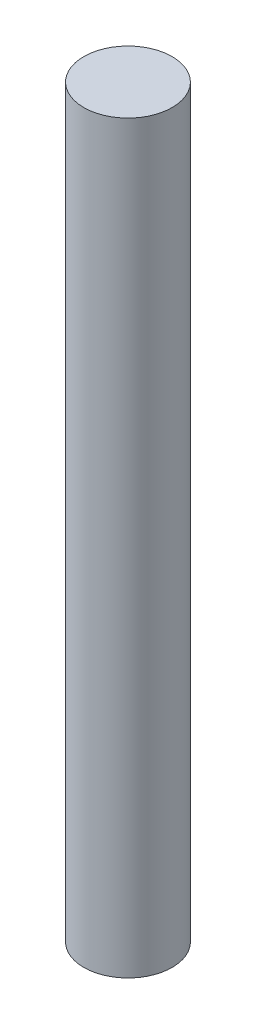
from build123d import *

# Parameters (mm, degrees)
SKETCH1_R           = 8
BOSS_EXTRUDE1_DEPTH = 134.9


with BuildPart() as part:
    # Sketch1 → Boss-Extrude1 (new body)
    with BuildSketch(Plane(origin=(0, 0, 0), x_dir=(1, 0, 0), z_dir=(0, 1, 0))):
        with Locations(Location((0, 0, 0), (0, 0, 270))):
            Circle(SKETCH1_R)
    extrude(amount=BOSS_EXTRUDE1_DEPTH)


solid = part.part
